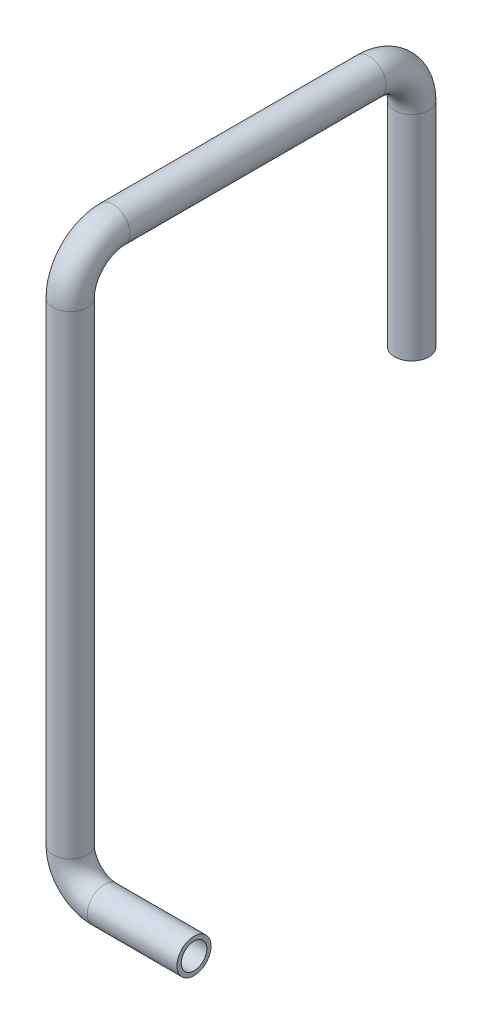
from build123d import *

# Parameters (mm, degrees)
TUBE_PROFILE_R   = 4
TUBE_PROFILE_R_2 = 3


with BuildPart() as part:
    # Tube: sweep along a curve in space
    with BuildLine() as tube_path:
        Line((59, 21, 40), (38, 21, 40))
        ThreePointArc((30, 29, 40), (32.343145751, 23.343145751, 40), (38, 21, 40))
        Line((30, 29, 40), (30, 140, 40))
        ThreePointArc((30, 150, 30), (30, 147.071067812, 37.071067812), (30, 140, 40))
        Line((30, 150, 30), (30, 150, -30))
        ThreePointArc((30, 140, -40), (30, 147.071067812, -37.071067812), (30, 150, -30))
        Line((30, 140, -40), (30, 90, -40))
    # Tube profile (on start of the path) → Tube (sweep)
    with BuildSketch(Plane(origin=(59, 21, 40), x_dir=(0, 0, -1), z_dir=(-1, 0, 0))):
        Circle(TUBE_PROFILE_R)
        Circle(TUBE_PROFILE_R_2, mode=Mode.SUBTRACT)
    sweep(path=tube_path.line)


solid = part.part
